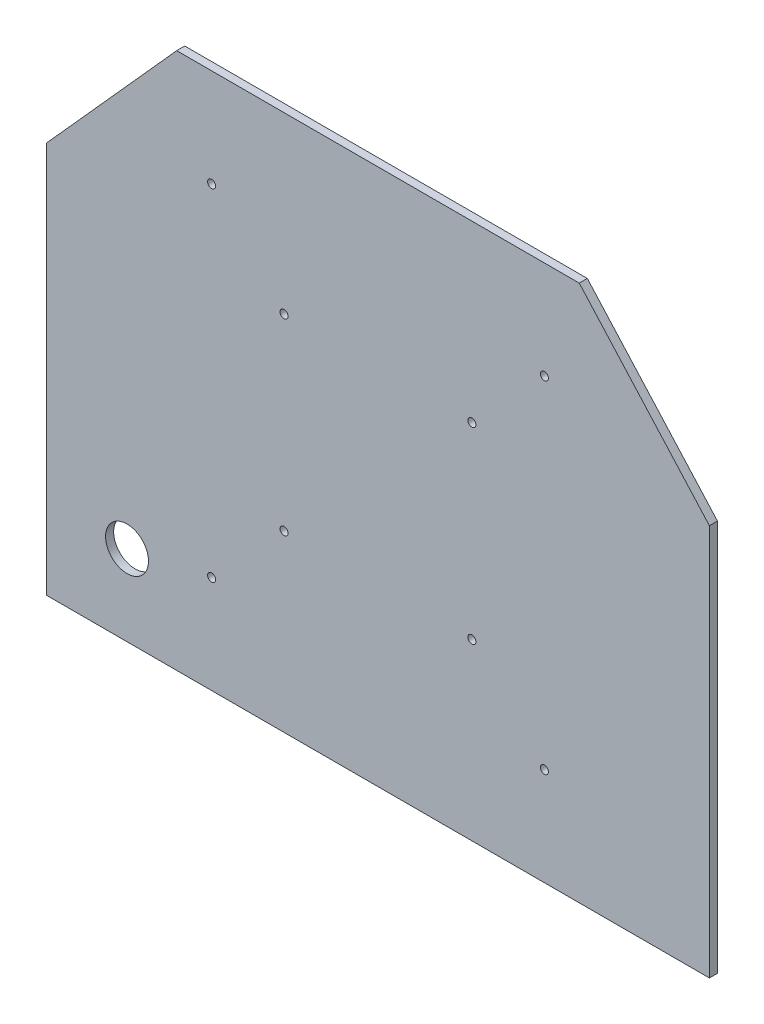
from build123d import *

# Parameters (mm, degrees)
BOSS_EXTRU_1_DEPTH      = 3
ENL_V_MAT_EXTRU_1_DEPTH = 345.268848431
ESQUISSE3_R             = 1.5
ENL_V_MAT_EXTRU_2_DEPTH = 331.898715622
ESQUISSE4_R             = 8
ENL_V_MAT_EXTRU_3_DEPTH = 331.898715622
ESQUISSE5_R             = 1.5
ENL_V_MAT_EXTRU_4_DEPTH = 331.898715622


with BuildPart() as part:
    # Esquisse1 → Boss.-Extru.1 (new body)
    with BuildSketch(Plane.XY):
        Polygon((0, 0), (0, 127.45), (65.1, 200), (215.1, 200), (280.2, 127.45), (280.2, 0), align=None)
    extrude(amount=BOSS_EXTRU_1_DEPTH)

    # Esquisse2 → Enlèv. mat.-Extru.1 (cut, through all)
    with BuildSketch(Plane(origin=(0, 0, 0), x_dir=(-1, 0, 0), z_dir=(0, 0, -1))):
        Polygon((-16.6, 0), (-16.6, 145.969439351), (0, 127.45), (0, 0), align=None)
        Polygon((-280.2, 127.45), (-263.6, 145.969439351), (-263.6, 0), (-280.2, 0), align=None)
    extrude(amount=-ENL_V_MAT_EXTRU_1_DEPTH, mode=Mode.SUBTRACT)

    # Esquisse3 → Enlèv. mat.-Extru.2 (cut, through all)
    with BuildSketch(Plane.XY.offset(3)):
        with Locations((78.1, 163.5)):
            Circle(ESQUISSE3_R)
        with Locations((78.1, 36.5)):
            Circle(ESQUISSE3_R)
        with Locations(Location((202.1, 36.5, 0), (0, 0, 180))):
            Circle(ESQUISSE3_R)
        with Locations(Location((202.1, 163.5, 0), (0, 0, 180))):
            Circle(ESQUISSE3_R)
    extrude(amount=-ENL_V_MAT_EXTRU_2_DEPTH, mode=Mode.SUBTRACT)

    # Esquisse4 → Enlèv. mat.-Extru.3 (cut, through all)
    with BuildSketch(Plane.XY.offset(3)):
        with Locations((46.6, 30)):
            Circle(ESQUISSE4_R)
    extrude(amount=-ENL_V_MAT_EXTRU_3_DEPTH, mode=Mode.SUBTRACT)

    # Esquisse5 → Enlèv. mat.-Extru.4 (cut, through all)
    with BuildSketch(Plane.XY.offset(3)):
        with Locations((105.1, 65)):
            Circle(ESQUISSE5_R)
        with Locations((105.1, 135)):
            Circle(ESQUISSE5_R)
        with Locations((175.1, 135)):
            Circle(ESQUISSE5_R)
        with Locations((175.1, 65)):
            Circle(ESQUISSE5_R)
    extrude(amount=-ENL_V_MAT_EXTRU_4_DEPTH, mode=Mode.SUBTRACT)


solid = part.part
